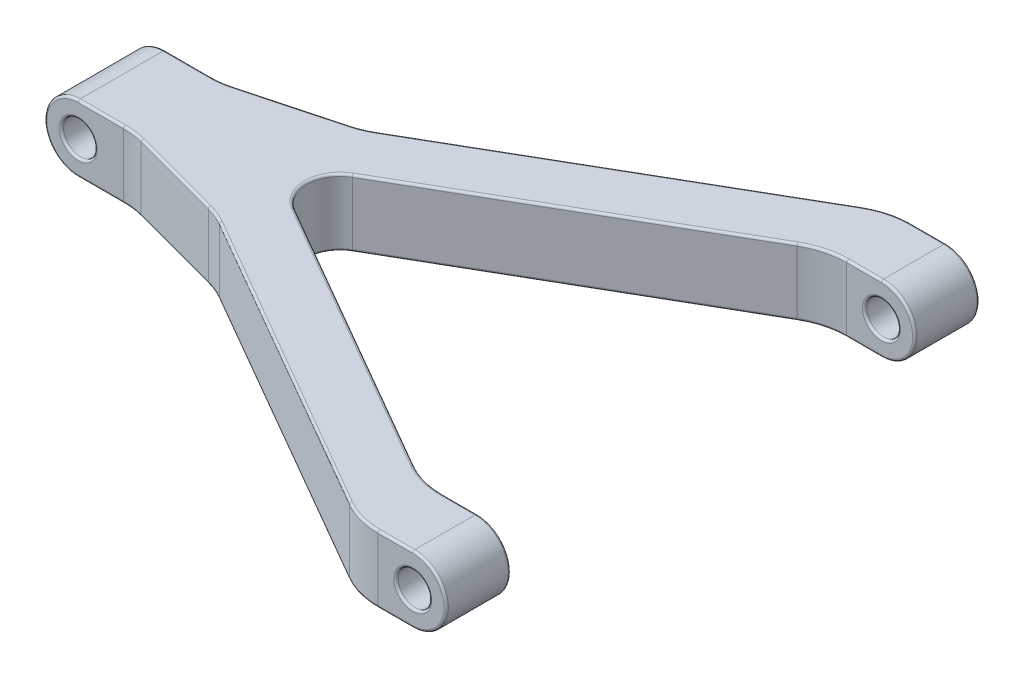
from build123d import *

# Parameters (mm, degrees)
SALIENTE_EXTRUIR1_DEPTH    = 60
CROQUIS2_R                 = 30
SALIENTE_EXTRUIR2_DEPTH    = 78
CORTAR_EXTRUIR1_REACH      = 419.214
CROQUIS3_R                 = 15
CROQUIS4_R                 = 30
SALIENTE_EXTRUIR3_DEPTH    = 57.74
SALIENTE_EXTRUIR4_START    = -57.74
CROQUIS5_R                 = 30
SALIENTE_EXTRUIR4_DEPTH    = 57.74
CORTAR_EXTRUIR2_DEPTH      = 587.927051251
CORTAR_EXTRUIR2_DEPTH_BACK = 587.927051251
CROQUIS6_R                 = 15
REDONDEO1_R                = 70
REDONDEO2_R                = 2


with BuildPart() as part:
    # Croquis1 → Saliente-Extruir1 (new body)
    with BuildSketch(Plane(origin=(0, 0, 0), x_dir=(1, 0, 0), z_dir=(0, 1, 0))):
        with BuildLine():
            Line((-194.739856991, -39), (-194.739856991, 39))
            Line((-194.739856991, 39), (-144.739856991, 39))
            Line((-144.739856991, 39), (-44.739856991, 65.794919243))
            Line((-44.739856991, 65.794919243), (255.260143009, 239))
            Line((255.260143009, 239), (305.260143009, 239))
            Line((305.260143009, 239), (305.260143009, 181.26))
            Line((305.260143009, 181.26), (255.25152938, 181.26))
            Line((255.25152938, 181.26), (-13.7, 25.980762114))
            ThreePointArc((-13.7, 25.980762114), (-28.7, 0), (-13.7, -25.980762114))
            Line((-13.7, -25.980762114), (255.25152938, -181.26))
            Line((255.25152938, -181.26), (305.260143009, -181.26))
            Line((305.260143009, -181.26), (305.260143009, -239))
            Line((305.260143009, -239), (255.260143009, -239))
            Line((255.260143009, -239), (-44.739856991, -65.794919243))
            Line((-44.739856991, -65.794919243), (-144.739856991, -39))
            Line((-144.739856991, -39), (-194.739856991, -39))
        make_face()
    extrude(amount=SALIENTE_EXTRUIR1_DEPTH)

    # Croquis2 → Saliente-Extruir2 (add)
    with BuildSketch(Plane.XY.offset(39)):
        with Locations((-194.739856991, 30)):
            Circle(CROQUIS2_R)
    extrude(amount=-SALIENTE_EXTRUIR2_DEPTH)

    # Croquis3 → Cortar-Extruir1 (cut, up to next)
    with BuildSketch(Plane.XY.offset(39), mode=Mode.PRIVATE) as cortar_extruir1_sk1:
        with Locations((-194.739856991, 30)):
            Circle(CROQUIS3_R)
    cortar_extruir1_tool1 = extrude(cortar_extruir1_sk1.sketch, amount=-CORTAR_EXTRUIR1_REACH, mode=Mode.PRIVATE) & part.part
    add(cortar_extruir1_tool1.solids().sort_by_distance((-194.739857, 30, 39))[0], mode=Mode.SUBTRACT)

    # Croquis4 → Saliente-Extruir3 (add)
    with BuildSketch(Plane.XY.offset(239)):
        with Locations((305.260143009, 30)):
            Circle(CROQUIS4_R)
    extrude(amount=-SALIENTE_EXTRUIR3_DEPTH)

    # Croquis5 → Saliente-Extruir4 (add)
    with BuildSketch(Plane(origin=(0, 0, -239), x_dir=(-1, 0, 0), z_dir=(0, 0, -1)).offset(SALIENTE_EXTRUIR4_START)):
        with Locations((-305.260143009, 30)):
            Circle(CROQUIS5_R)
    extrude(amount=SALIENTE_EXTRUIR4_DEPTH)

    # Croquis6 → Cortar-Extruir2 (cut, two sides: drawn at the far end of the back side and taken through both)
    with BuildSketch(Plane.XY.offset(239).offset(-CORTAR_EXTRUIR2_DEPTH_BACK)):
        with Locations(Location((305.260143009, 30, 0), (0, 0, 180))):
            Circle(CROQUIS6_R)
    extrude(amount=CORTAR_EXTRUIR2_DEPTH + CORTAR_EXTRUIR2_DEPTH_BACK, mode=Mode.SUBTRACT)

    # Redondeo1
    redondeo1_edges = [part.edges().sort_by_distance(p)[0] for p in [
        (255.25152938, 30, 181.26),
        (255.25152938, 30, -181.26),
        (255.260143009, 30, -239),
        (-44.739856991, 30, -65.794919243),
        (-144.739856991, 30, -39),
        (-144.739856991, 30, 39),
        (-44.739856991, 30, 65.794919243),
        (255.260143009, 30, 239),
    ]]
    fillet(redondeo1_edges, radius=REDONDEO1_R)

    # Redondeo2
    redondeo2_edges = [part.edges().sort_by_distance(p)[0] for p in [
        (101.128869002, 0, -150.012267462),
        (101.128869002, 60, -150.012267462),
        (289.63405793, 0, 181.26),
        (289.638364744, 0, 239),
        (289.638364744, 0, -239),
        (112.653986425, 0, -98.931270189),
        (255.899253322, 0, 236.61480784),
        (255.899253322, 0, -236.61480784),
        (289.638364744, 60, -239),
        (289.63405793, 60, 181.26),
        (112.653986425, 60, -98.931270189),
        (289.638364744, 60, 239),
        (255.899253322, 60, 236.61480784),
        (255.899253322, 60, -236.61480784),
        (-44.971008209, 0, 66.352967648),
        (-44.971008209, 60, 66.352967648),
        (-144.818698367, 0, 39.598859704),
        (-144.818698367, 60, 39.598859704),
        (-144.818698367, 0, -39.598859704),
        (-144.818698367, 60, -39.598859704),
        (-44.971008209, 0, -66.352967648),
        (-44.971008209, 60, -66.352967648),
        (255.890639693, 0, -178.87480784),
        (255.890639693, 60, -178.87480784),
        (255.890639693, 0, 178.87480784),
        (255.890639693, 60, 178.87480784),
        (112.653986425, 0, 98.931270189),
        (-28.7, 0, 0),
        (289.63405793, 0, -181.26),
        (-174.347694407, 0, -39),
        (-174.347694407, 0, 39),
        (-174.347694407, 60, 39),
        (-174.347694407, 60, -39),
        (-224.739856991, 30, -39),
        (-224.739856991, 30, 39),
        (289.63405793, 60, -181.26),
        (-209.739856991, 30, -39),
        (-209.739856991, 30, 39),
        (-28.7, 60, 0),
        (335.260143009, 30, 239),
        (335.260143009, 30, 181.26),
        (112.653986425, 60, 98.931270189),
        (335.260143009, 30, -181.26),
        (335.260143009, 30, -239),
        (320.260143009, 30, -181.26),
        (320.260143009, 30, 181.26),
        (320.260143009, 30, 239),
        (320.260143009, 30, -239),
        (101.128869002, 0, 150.012267462),
        (101.128869002, 60, 150.012267462),
        (-94.739856991, 0, 52.397459622),
        (-94.739856991, 60, 52.397459622),
        (-94.739856991, 0, -52.397459622),
        (-94.739856991, 60, -52.397459622),
    ]]
    fillet(redondeo2_edges, radius=REDONDEO2_R)


solid = part.part
